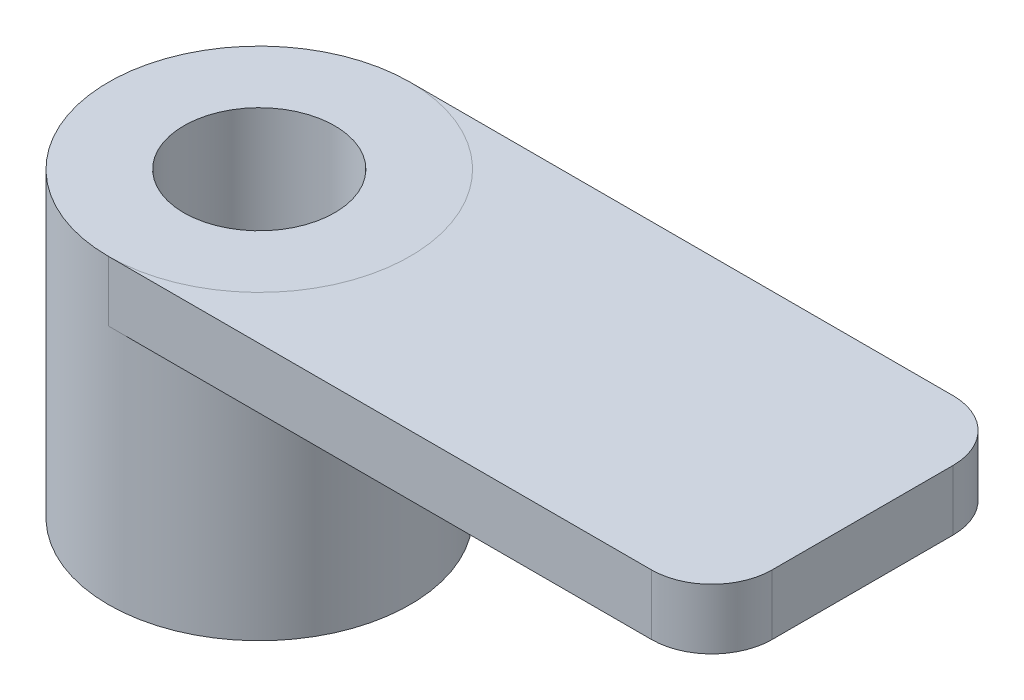
from build123d import *

# Parameters (mm, degrees)
SKETCH1_R           = 6.35
SKETCH1_R_2         = 3.175
BOSS_EXTRUDE1_DEPTH = 12.7
BOSS_EXTRUDE2_DEPTH = 2.54
FILLET1_R           = 2.54


with BuildPart() as part:
    # Sketch1 → Boss-Extrude1 (new body)
    with BuildSketch(Plane(origin=(0, 0, 0), x_dir=(1, 0, 0), z_dir=(0, 1, 0))):
        with Locations(Location((0, 0, 0), (0, 0, 270))):
            Circle(SKETCH1_R)
        with Locations(Location((0, 0, 0), (0, 0, 270))):
            Circle(SKETCH1_R_2, mode=Mode.SUBTRACT)
    extrude(amount=BOSS_EXTRUDE1_DEPTH)


with BuildPart() as body_2:
    # Sketch2 → Boss-Extrude2 (new body)
    with BuildSketch(Plane(origin=(0, 12.7, 0), x_dir=(1, 0, 0), z_dir=(0, 1, 0))):
        with BuildLine():
            Line((0, 6.35), (25.4, 6.35))
            Line((25.4, 6.35), (25.4, -6.35))
            Line((25.4, -6.35), (0, -6.35))
            ThreePointArc((0, -6.35), (6.35, 0), (0, 6.35))
        make_face()
    extrude(amount=-BOSS_EXTRUDE2_DEPTH)

    # Fillet1
    fillet1_edges = [body_2.edges().sort_by_distance(p)[0] for p in [
        (25.4, 11.43, -6.35),
        (25.4, 11.43, 6.35),
    ]]
    fillet(fillet1_edges, radius=FILLET1_R)


solid = Compound([part.part, body_2.part])
